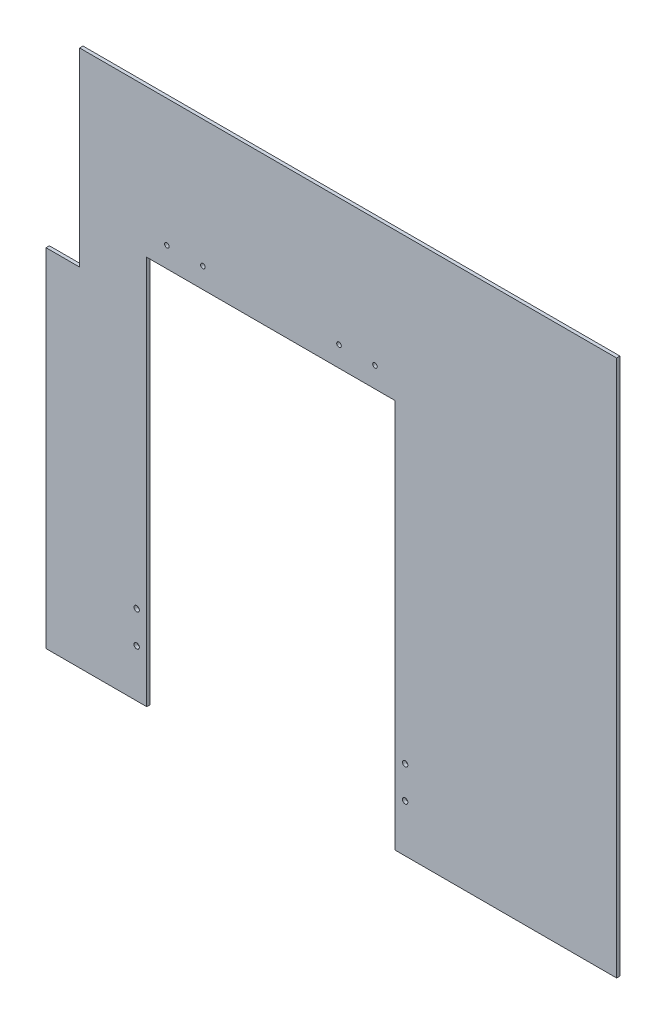
from build123d import *

# Parameters (mm, degrees)
SKETCH1_W           = 539.75
SKETCH1_H           = 508
BOSS_EXTRUDE1_DEPTH = 3.175
SKETCH2_R           = 2.54
SKETCH2_R_2         = 3.175
SKETCH2_W           = 234.95
SKETCH2_H           = 368.3
CUT_EXTRUDE1_DEPTH  = 44.45
SKETCH4_R           = 2.159
CUT_EXTRUDE3_DEPTH  = 742.218013222
CUT_EXTRUDE4_DEPTH  = 742.218013222


with BuildPart() as part:
    # Sketch1 → Boss-Extrude1 (new body)
    with BuildSketch(Plane.XY):
        with Locations((269.875, 254)):
            Rectangle(SKETCH1_W, SKETCH1_H)
    extrude(amount=BOSS_EXTRUDE1_DEPTH)

    # Sketch2 → Cut-Extrude1 (cut)
    with BuildSketch(Plane(origin=(0, 0, 0), x_dir=(-1, 0, 0), z_dir=(0, 0, -1))):
        with Locations((-339.725, 45.085)):
            Circle(SKETCH2_R)
        with Locations((-85.725, 45.085)):
            Circle(SKETCH2_R)
        with Locations((-15.24, 365.76)):
            Circle(SKETCH2_R_2)
        with Locations((-339.725, 75.565)):
            Circle(SKETCH2_R)
        with Locations((-85.725, 75.565)):
            Circle(SKETCH2_R)
        with Locations((-212.725, 184.15)):
            Rectangle(SKETCH2_W, SKETCH2_H)
    extrude(amount=-CUT_EXTRUDE1_DEPTH, mode=Mode.SUBTRACT)

    # Sketch4 → Cut-Extrude3 (cut, through all)
    with BuildSketch(Plane(origin=(0, 0, 0), x_dir=(-1, 0, 0), z_dir=(0, 0, -1))):
        with Locations((-311.1754, 387.604)):
            Circle(SKETCH4_R)
        with Locations((-277.1394, 387.604)):
            Circle(SKETCH4_R)
        with Locations((-148.3614, 387.604)):
            Circle(SKETCH4_R)
        with Locations((-114.3254, 387.604)):
            Circle(SKETCH4_R)
    extrude(amount=-CUT_EXTRUDE3_DEPTH, mode=Mode.SUBTRACT)

    # Sketch5 → Cut-Extrude4 (cut, through all)
    with BuildSketch(Plane.XY.offset(3.175)):
        Polygon((0, 403.06625), (0, 328.45375), (31.75, 328.45375), (31.75, 403.06625), (31.75, 508), (0, 508), align=None)
    extrude(amount=-CUT_EXTRUDE4_DEPTH, mode=Mode.SUBTRACT)


solid = part.part
